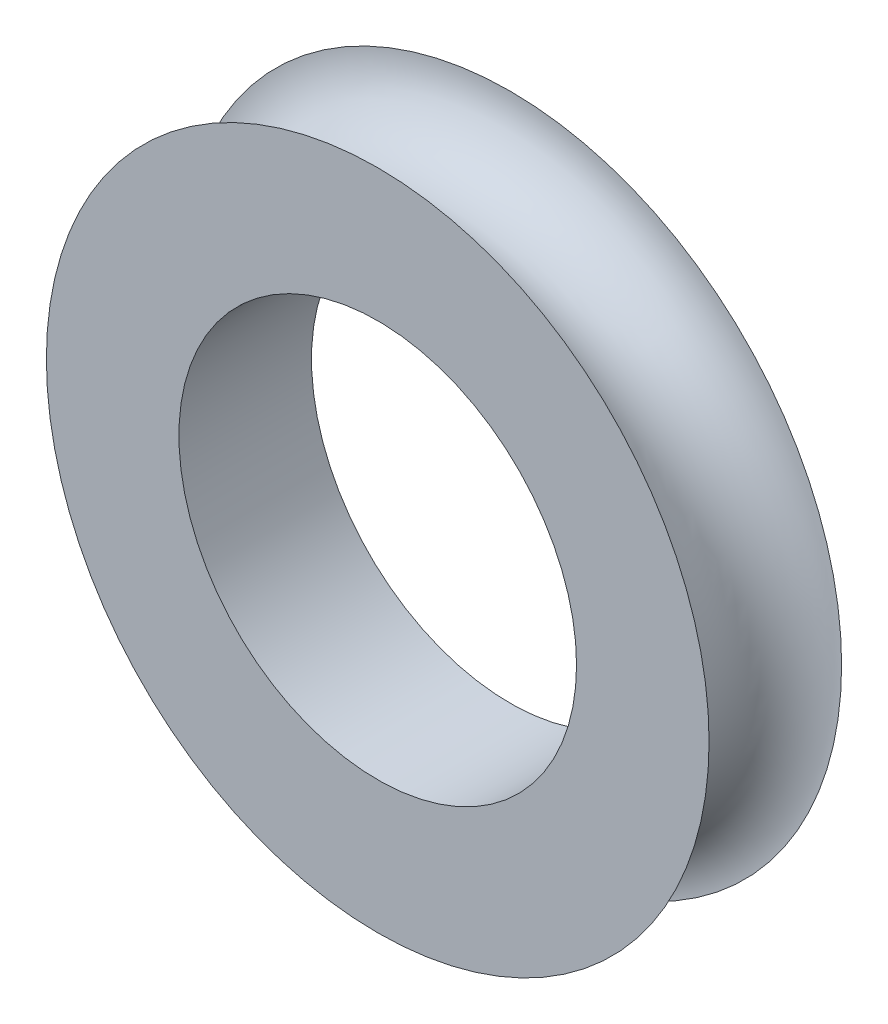
from build123d import *

# Parameters (mm, degrees)
SKETCH1_R           = 5
SKETCH1_R_2         = 3
BOSS_EXTRUDE1_DEPTH = 2


with BuildPart() as part:
    # Sketch1 → Boss-Extrude1 (new body)
    with BuildSketch(Plane.XY):
        Circle(SKETCH1_R)
        Circle(SKETCH1_R_2, mode=Mode.SUBTRACT)
    extrude(amount=BOSS_EXTRUDE1_DEPTH)

    # Sketch2 → Cut-Revolve1 (revolve, cut)
    with BuildSketch(Plane(origin=(0, 0, 0), x_dir=(0, 0, -1), z_dir=(1, 0, 0)), mode=Mode.PRIVATE) as cut_revolve1_sk:
        with BuildLine():
            Line((-2, 5), (0, 5))
            ThreePointArc((0, 5), (-1, 4), (-2, 5))
        make_face()
    revolve(cut_revolve1_sk.sketch.rotate(Axis((0, 0, 2), (0, 0, -1)), 90), axis=Axis((0, 0, 2), (0, 0, -1)), mode=Mode.SUBTRACT)


solid = part.part
